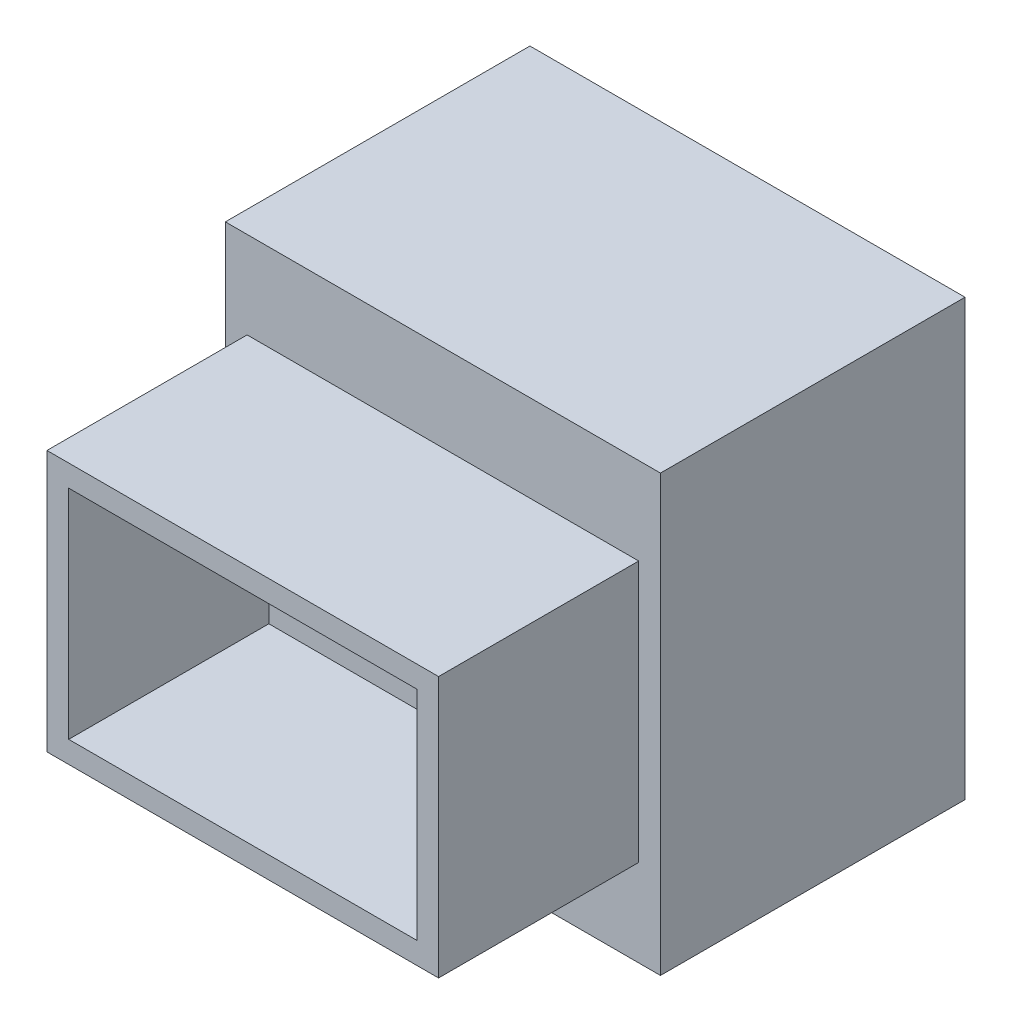
from build123d import *

# Parameters (mm, degrees)
SKETCH1_W           = 100
SKETCH1_H           = 100
BOSS_EXTRUDE1_DEPTH = 70
SKETCH2_W           = 90
SKETCH2_H           = 60
SKETCH2_W_2         = 80
SKETCH2_H_2         = 50
BOSS_EXTRUDE2_DEPTH = 46


with BuildPart() as part:
    # Sketch1 → Boss-Extrude1 (new body)
    with BuildSketch(Plane.XY):
        Rectangle(SKETCH1_W, SKETCH1_H)
    extrude(amount=BOSS_EXTRUDE1_DEPTH)

    # Sketch2 → Boss-Extrude2 (add)
    with BuildSketch(Plane.XY.offset(70)):
        Rectangle(SKETCH2_W, SKETCH2_H)
        Rectangle(SKETCH2_W_2, SKETCH2_H_2, mode=Mode.SUBTRACT)
    extrude(amount=BOSS_EXTRUDE2_DEPTH)


solid = part.part
